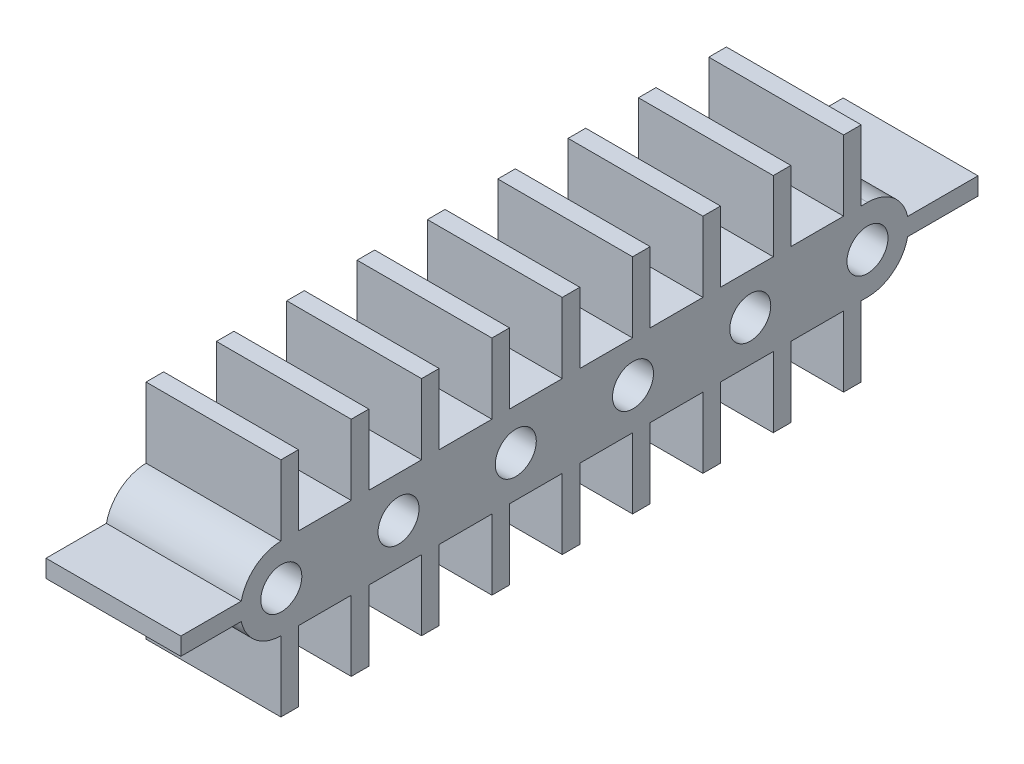
from build123d import *

# Parameters (mm, degrees)
SKETCH1_R           = 17.5
BOSS_EXTRUDE1_DEPTH = 115


with BuildPart() as part:
    # Sketch1 → Boss-Extrude1 (new body)
    with BuildSketch(Plane(origin=(0, 0, 0), x_dir=(0, 0, -1), z_dir=(1, 0, 0))):
        with BuildLine():
            Line((-250.081967213, 35), (-205.081967213, 35))
            Line((-205.081967213, 35), (-205.081967213, 95))
            Line((-205.081967213, 95), (-190.081967213, 95))
            Line((-190.081967213, 95), (-190.081967213, 35))
            Line((-190.081967213, 35), (-185.081967213, 35))
            Line((-185.081967213, 35), (-145.081967213, 35))
            Line((-145.081967213, 35), (-145.081967213, 95))
            Line((-145.081967213, 95), (-130.081967213, 95))
            Line((-130.081967213, 95), (-130.081967213, 35))
            Line((-130.081967213, 35), (-85.081967213, 35))
            Line((-85.081967213, 35), (-85.081967213, 95))
            Line((-85.081967213, 95), (-70.081967213, 95))
            Line((-70.081967213, 95), (-70.081967213, 35))
            Line((-70.081967213, 35), (-25.081967213, 35))
            Line((-25.081967213, 35), (-25.081967213, 95))
            Line((-25.081967213, 95), (-10.081967213, 95))
            Line((-10.081967213, 95), (-10.081967213, 35))
            Line((-10.081967213, 35), (34.918032787, 35))
            Line((34.918032787, 35), (34.918032787, 95))
            Line((34.918032787, 95), (49.918032787, 95))
            Line((49.918032787, 95), (49.918032787, 35))
            Line((49.918032787, 35), (94.918032787, 35))
            Line((94.918032787, 35), (94.918032787, 95))
            Line((94.918032787, 95), (109.918032787, 95))
            Line((109.918032787, 95), (109.918032787, 35))
            Line((109.918032787, 35), (154.918032787, 35))
            Line((154.918032787, 35), (154.918032787, 95))
            Line((154.918032787, 95), (169.918032787, 95))
            Line((169.918032787, 95), (169.918032787, 35))
            Line((169.918032787, 35), (214.918032787, 35))
            Line((214.918032787, 35), (214.918032787, 95))
            Line((214.918032787, 95), (229.918032787, 95))
            Line((229.918032787, 95), (229.918032787, 35))
            Line((229.918032787, 35), (235.374517149, 35))
            ThreePointArc((235.374517149, 35), (257.311928117, 27.271780287), (269.561502977, 7.5))
            Line((269.561502977, 7.5), (329.561502977, 7.5))
            Line((329.561502977, 7.5), (329.561502977, -7.5))
            Line((329.561502977, -7.5), (269.561502977, -7.5))
            ThreePointArc((269.561502977, -7.5), (257.311928117, -27.271780287), (235.374517149, -35))
            Line((235.374517149, -35), (229.918032787, -35))
            Line((229.918032787, -35), (229.918032787, -95))
            Line((229.918032787, -95), (214.918032787, -95))
            Line((214.918032787, -95), (214.918032787, -35))
            Line((214.918032787, -35), (169.918032787, -35))
            Line((169.918032787, -35), (169.918032787, -95))
            Line((169.918032787, -95), (154.918032787, -95))
            Line((154.918032787, -95), (154.918032787, -35))
            Line((154.918032787, -35), (109.918032787, -35))
            Line((109.918032787, -35), (109.918032787, -95))
            Line((109.918032787, -95), (94.918032787, -95))
            Line((94.918032787, -95), (94.918032787, -35))
            Line((94.918032787, -35), (49.918032787, -35))
            Line((49.918032787, -35), (49.918032787, -95))
            Line((49.918032787, -95), (34.918032787, -95))
            Line((34.918032787, -95), (34.918032787, -35))
            Line((34.918032787, -35), (-10.081967213, -35))
            Line((-10.081967213, -35), (-10.081967213, -95))
            Line((-10.081967213, -95), (-25.081967213, -95))
            Line((-25.081967213, -95), (-25.081967213, -35))
            Line((-25.081967213, -35), (-70.081967213, -35))
            Line((-70.081967213, -35), (-70.081967213, -95))
            Line((-70.081967213, -95), (-85.081967213, -95))
            Line((-85.081967213, -95), (-85.081967213, -35))
            Line((-85.081967213, -35), (-130.081967213, -35))
            Line((-130.081967213, -35), (-130.081967213, -95))
            Line((-130.081967213, -95), (-145.081967213, -95))
            Line((-145.081967213, -95), (-145.081967213, -35))
            Line((-145.081967213, -35), (-190.081967213, -35))
            Line((-190.081967213, -35), (-190.081967213, -95))
            Line((-190.081967213, -95), (-205.081967213, -95))
            Line((-205.081967213, -95), (-205.081967213, -35))
            Line((-205.081967213, -35), (-250.081967213, -35))
            Line((-250.081967213, -35), (-250.081967213, -95))
            Line((-250.081967213, -95), (-265.081967213, -95))
            Line((-265.081967213, -95), (-265.081967213, -35))
            ThreePointArc((-265.081967213, -35), (-286.793224125, -27.156121863), (-298.898676377, -7.5))
            Line((-298.898676377, -7.5), (-350.428459553, -7.5))
            Line((-350.428459553, -7.5), (-350.428459553, 7.5))
            Line((-350.428459553, 7.5), (-298.898676377, 7.5))
            ThreePointArc((-298.898676377, 7.5), (-286.793224125, 27.156121863), (-265.081967213, 35))
            Line((-265.081967213, 35), (-265.081967213, 95))
            Line((-265.081967213, 95), (-250.081967213, 95))
            Line((-250.081967213, 95), (-250.081967213, 35))
        make_face()
        with Locations((-264.709663373, 0)):
            Circle(SKETCH1_R, mode=Mode.SUBTRACT)
        with Locations((-164.709663373, 0)):
            Circle(SKETCH1_R, mode=Mode.SUBTRACT)
        with Locations((-64.709663373, 0)):
            Circle(SKETCH1_R, mode=Mode.SUBTRACT)
        with Locations((35.290336627, 0)):
            Circle(SKETCH1_R, mode=Mode.SUBTRACT)
        with Locations((135.290336627, 0)):
            Circle(SKETCH1_R, mode=Mode.SUBTRACT)
        with Locations((235.290336627, 0)):
            Circle(SKETCH1_R, mode=Mode.SUBTRACT)
    extrude(amount=BOSS_EXTRUDE1_DEPTH)


solid = part.part
